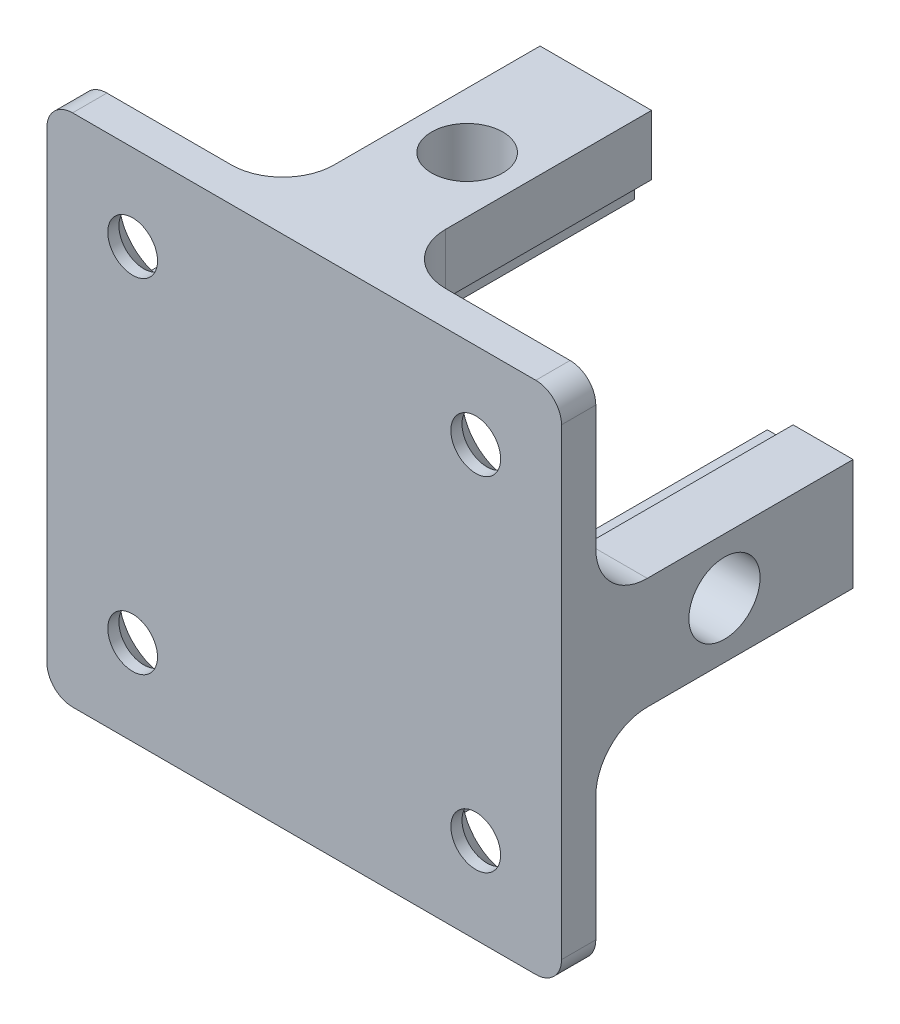
from build123d import *

# Parameters (mm, degrees)
SKETCH1_W                                            = 60
SKETCH1_H                                            = 60
BOSS_EXTRUDE1_DEPTH                                  = 4
BOSS_EXTRUDE2_DEPTH                                  = 30
CSK_FOR_M5_HEX_SOCKET_COUNTERSUNK_CAP_SC_D           = 5.8
CSK_FOR_M5_HEX_SOCKET_COUNTERSUNK_CAP_SC_DEPTH       = 4
CSK_FOR_M5_HEX_SOCKET_COUNTERSUNK_CAP_SC_CSINK_D     = 11.2
CSK_FOR_M5_HEX_SOCKET_COUNTERSUNK_CAP_SC_CSINK_ANGLE = 90
CSK_FOR_M5_HEX_SOCKET_COUNTERSUNK_CAP_SC_TIP         = 1.742495795
FILLET1_R                                            = 3
FILLET2_R                                            = 6
CUT_EXTRUDE1_REACH                                   = 87.184
SKETCH8_R                                            = 4.15
CIRPATTERN1_COUNT                                    = 4


with BuildPart() as part:
    # Sketch1 → Boss-Extrude1 (new body)
    with BuildSketch(Plane.XY):
        with Locations((-22.5, 22.5)):
            Rectangle(SKETCH1_W, SKETCH1_H)
    extrude(amount=BOSS_EXTRUDE1_DEPTH)

    # Sketch1<3> → Boss-Extrude2 (add)
    with BuildSketch(Plane.XY):
        Polygon((-29, -0.5), (-29, -7.5), (-16, -7.5), (-16, -0.5), (-18, -0.5), (-18, 2.5), (-27, 2.5), (-27, -0.5), align=None)
        Polygon((-52.5, 29), (-52.5, 16), (-45.5, 16), (-45.5, 18), (-42.5, 18), (-42.5, 27), (-45.5, 27), (-45.5, 29), align=None)
        Polygon((0.5, 16), (7.5, 16), (7.5, 29), (0.5, 29), (0.5, 27), (-2.5, 27), (-2.5, 18), (0.5, 18), align=None)
        Polygon((-16, 52.5), (-29, 52.5), (-29, 45.5), (-27, 45.5), (-27, 42.5), (-18, 42.5), (-18, 45.5), (-16, 45.5), align=None)
    extrude(amount=-BOSS_EXTRUDE2_DEPTH)

    # CSK for M5 Hex Socket Countersunk Cap Screw1
    with Locations(Plane(origin=(0, 0, 0), x_dir=(-1, 0, 0), z_dir=(0, 0, -1))):
        with Locations((2.5, 42.5), (42.5, 42.5), (42.5, 2.5), (2.5, 2.5)):
            CounterSinkHole(CSK_FOR_M5_HEX_SOCKET_COUNTERSUNK_CAP_SC_D / 2, CSK_FOR_M5_HEX_SOCKET_COUNTERSUNK_CAP_SC_CSINK_D / 2, depth=CSK_FOR_M5_HEX_SOCKET_COUNTERSUNK_CAP_SC_DEPTH, counter_sink_angle=CSK_FOR_M5_HEX_SOCKET_COUNTERSUNK_CAP_SC_CSINK_ANGLE)
            with Locations((0, 0, -(CSK_FOR_M5_HEX_SOCKET_COUNTERSUNK_CAP_SC_DEPTH + CSK_FOR_M5_HEX_SOCKET_COUNTERSUNK_CAP_SC_TIP / 2))):  # 118° drill point
                Cone(0, CSK_FOR_M5_HEX_SOCKET_COUNTERSUNK_CAP_SC_D / 2, CSK_FOR_M5_HEX_SOCKET_COUNTERSUNK_CAP_SC_TIP, mode=Mode.SUBTRACT)

    # Fillet1
    fillet1_edges = [part.edges().sort_by_distance(p)[0] for p in [
        (-52.5, -7.5, 2),
        (7.5, -7.5, 2),
        (-52.5, 52.5, 2),
        (7.5, 52.5, 2),
    ]]
    fillet(fillet1_edges, radius=FILLET1_R)

    # Fillet2
    fillet2_edges = [part.edges().sort_by_distance(p)[0] for p in [
        (4, 16, 0),
        (4, 29, 0),
        (-16, 49, 0),
        (-29, 49, 0),
        (-49, 29, 0),
        (-49, 16, 0),
        (-29, -4, 0),
        (-16, -4, 0),
        (-22.5, 2.5, 0),
        (-42.5, 22.5, 0),
        (-22.5, 42.5, 0),
        (-2.5, 22.5, 0),
    ]]
    fillet(fillet2_edges, radius=FILLET2_R)

    # Sketch8 → Cut-Extrude1 (cut, up to next)
    with BuildSketch(Plane(origin=(7.5, 0, 0), x_dir=(0, 0, -1), z_dir=(1, 0, 0)), mode=Mode.PRIVATE) as cut_extrude1_sk1:
        with Locations((15, 22.5)):
            Circle(SKETCH8_R)
    cut_extrude1_tool1 = extrude(cut_extrude1_sk1.sketch, amount=-CUT_EXTRUDE1_REACH, mode=Mode.PRIVATE) & part.part
    cut_extrude1 = cut_extrude1_tool1.solids().sort_by_distance((7.5, 22.5, -15))[0]
    add(cut_extrude1, mode=Mode.SUBTRACT)

    # CirPattern1: Cut-Extrude1 ×4 about axis
    cirpattern1_axis = Axis((-22.5, 22.5, 0), (0, 0, -1))
    for i in range(1, CIRPATTERN1_COUNT):
        add(cut_extrude1.rotate(cirpattern1_axis, i * 360 / CIRPATTERN1_COUNT), mode=Mode.SUBTRACT)


solid = part.part
